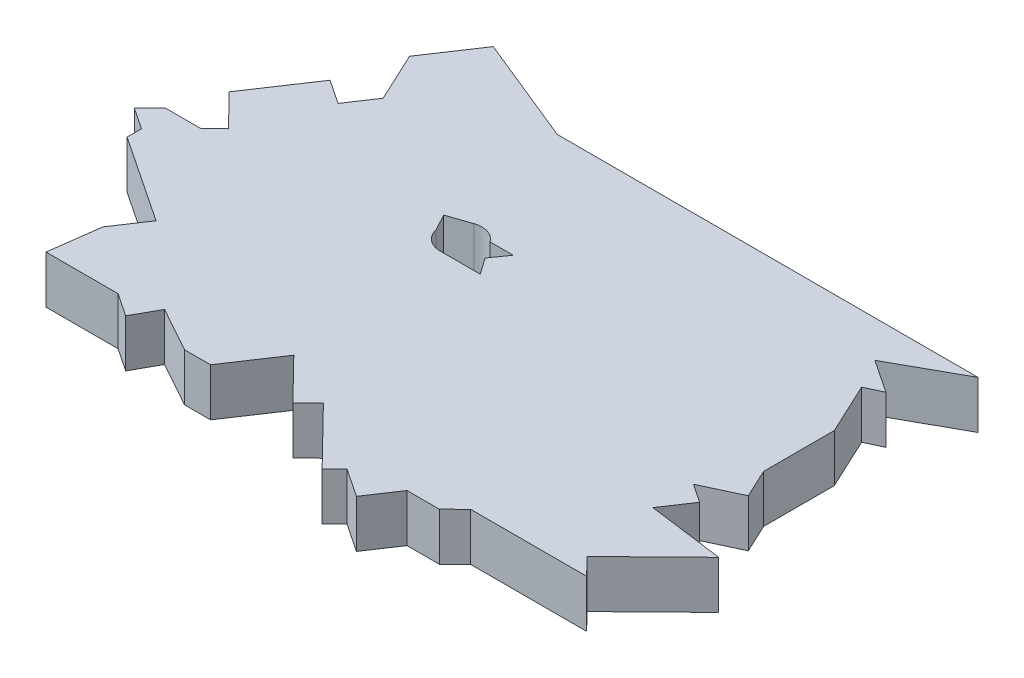
from build123d import *

# Parameters (mm, degrees)
BOSS_EXTRUDE1_DEPTH = 12.7


with BuildPart() as part:
    # Sketch1 → Boss-Extrude1 (new body)
    with BuildSketch(Plane(origin=(0, 0, 0), x_dir=(1, 0, 0), z_dir=(0, 1, 0))):
        Polygon((-30.787184834, 46.060147433), (67.424215816, 46.060147433), (81.144259733, 46.060147433), (63.504203269, 36.260116064), (72.324231501, 30.380097243), (67.914217385, 28.322090655), (74.284237775, 14.672046963), (74.284237775, 9.604030741), (74.284237775, -4.116013175), (77.864468212, -11.787935542), (67.914217385, -16.431385928), (72.889342799, -19.748136204), (67.914217385, -27.210824325), (88.124897461, -29.905172646), (70.401780092, -47.236151197), (74.914322429, -51.850796426), (44.070310984, -51.850796426), (39.838958686, -55.98852651), (31.251122176, -55.98852651), (25.875987108, -64.051229112), (18.318515491, -59.012914701), (14.969602654, -62.287730036), (4.763594942, -51.850796426), (0, -46.979418158), (-4.105003947, -50.993595454), (-14.998499331, -39.853618754), (-23.862315978, -53.149343726), (-30.787184834, -53.149343726), (-42.728136767, -46.50148124), (-46.429188064, -53.149343726), (-52.566568213, -49.057756959), (-62.328199505, -49.057756959), (-71.736229619, -49.057756959), (-69.955147384, -35.697612338), (-64.297288709, -27.210824325), (-87.431621883, -11.787935542), (-87.431621883, -7.951974358), (-93.185563658, -4.116013175), (-88.976419646, 0), (-79.572998188, 0), (-75.864455296, 3.626488274), (-84.274708917, 12.227036224), (-78.094687193, 21.497068809), (-73.544672629, 28.322090655), (-67.126218046, 24.043120934), (-62.328199505, 31.240148746), (-68.47808372, 44.418472064), (-59.570897098, 57.779251997), align=None)
        with BuildLine():
            Line((-11.923576625, 7.986340539), (-8.84865392, 3.609452157))
            Line((-8.84865392, 3.609452157), (-19.546747498, 3.609452157))
            ThreePointArc((-19.546747498, 3.609452157), (-23.034496934, 4.839852529), (-24.978177568, 7.986340539))
            Line((-24.978177568, 7.986340539), (-27.332016626, 12.363228921))
            Line((-27.332016626, 12.363228921), (-21.358576046, 14.422806945))
            ThreePointArc((-21.358576046, 14.422806945), (-17.834303779, 14.456028923), (-14.998499331, 12.363228921))
            Line((-14.998499331, 12.363228921), (-8.84865392, 12.363228921))
            Line((-8.84865392, 12.363228921), (-11.923576625, 7.986340539))
        make_face(mode=Mode.SUBTRACT)
    extrude(amount=BOSS_EXTRUDE1_DEPTH)


solid = part.part
